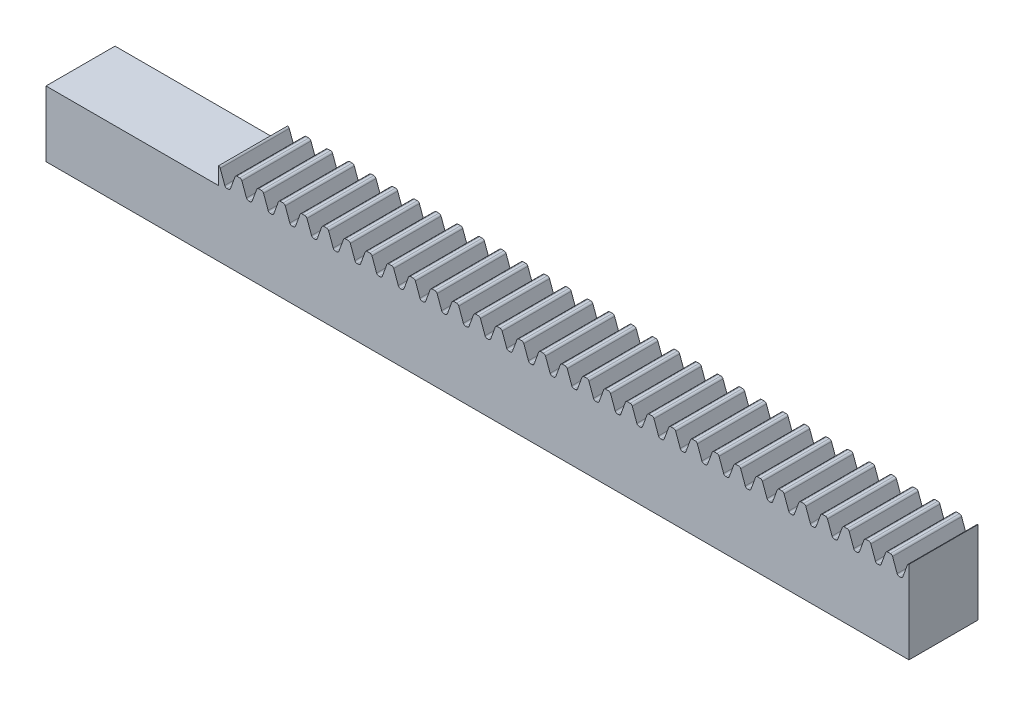
from build123d import *

# Parameters (mm, degrees)
BOSS_EXTRUDE1_DEPTH      = 5
BOSS_EXTRUDE1_DEPTH_BACK = 5
SKETCH3_W                = 100
SKETCH3_H                = 12
CUT_EXTRUDE1_DEPTH       = 51.606323716
LPATTERN1_COUNT          = 32
LPATTERN1_PITCH          = 3.141592654
LPATTERN1_COUNT_DIR2     = 2
LPATTERN1_PITCH_DIR2     = 3.141592654
SKETCH6_W                = 10
SKETCH6_H                = 9.5
BOSS_EXTRUDE3_DEPTH      = 25


with BuildPart() as part:
    # Sketch3 → Boss-Extrude1 (new, two sides: drawn at the far end of the back side and taken through both)
    with BuildSketch(Plane.XY.offset(-BOSS_EXTRUDE1_DEPTH_BACK)):
        Rectangle(SKETCH3_W, SKETCH3_H)
    extrude(amount=BOSS_EXTRUDE1_DEPTH + BOSS_EXTRUDE1_DEPTH_BACK)

    # Sketch4 → Cut-Extrude1 (cut, symmetric)
    with BuildSketch(Plane.XY):
        with BuildLine():
            Line((-47.625666184, 5.779244445), (-47.545317733, 6))
            Line((-47.545317733, 6), (-48.694686131, 6))
            Line((-48.694686131, 6), (-48.694686131, 3.75))
            Line((-48.694686131, 3.75), (-48.599173915, 3.75))
            ThreePointArc((-48.599173915, 3.75), (-48.406736132, 3.8106754), (-48.283902309, 3.970755555))
            Line((-48.283902309, 3.970755555), (-47.625666184, 5.779244445))
        make_face()
        with BuildLine():
            Line((-47.310394578, 6), (-47.545317733, 6))
            Line((-47.545317733, 6), (-47.625666184, 5.779244445))
            ThreePointArc((-47.625666184, 5.779244445), (-47.502832361, 5.9393246), (-47.310394578, 6))
        make_face()
        with BuildLine():
            Line((-46.622113424, 5.779244445), (-46.702461875, 6))
            Line((-46.702461875, 6), (-46.93738503, 6))
            ThreePointArc((-46.93738503, 6), (-46.744947247, 5.9393246), (-46.622113424, 5.779244445))
        make_face()
        with BuildLine():
            Line((-45.553093477, 3.75), (-45.553093477, 6))
            Line((-45.553093477, 6), (-46.702461875, 6))
            Line((-46.702461875, 6), (-46.622113424, 5.779244445))
            Line((-46.622113424, 5.779244445), (-45.963877299, 3.970755555))
            ThreePointArc((-45.963877299, 3.970755555), (-45.841043475, 3.8106754), (-45.648605692, 3.75))
            Line((-45.648605692, 3.75), (-45.553093477, 3.75))
        make_face()
    cut_extrude1 = extrude(amount=CUT_EXTRUDE1_DEPTH, both=True, mode=Mode.SUBTRACT)

    # LPattern1: Cut-Extrude1 32 × 2
    with Locations(*[Vector(1, 0, 0) * (i * LPATTERN1_PITCH) + Vector(-1, 0, 0) * (j * LPATTERN1_PITCH_DIR2) for i in range(LPATTERN1_COUNT) for j in range(LPATTERN1_COUNT_DIR2) if (i, j) != (0, 0)]):
        add(cut_extrude1, mode=Mode.SUBTRACT)

    # Sketch6 → Boss-Extrude3 (add)
    with BuildSketch(Plane.ZY.offset(50)):
        with Locations((0, -1.25)):
            Rectangle(SKETCH6_W, SKETCH6_H)
    extrude(amount=BOSS_EXTRUDE3_DEPTH)


solid = part.part
